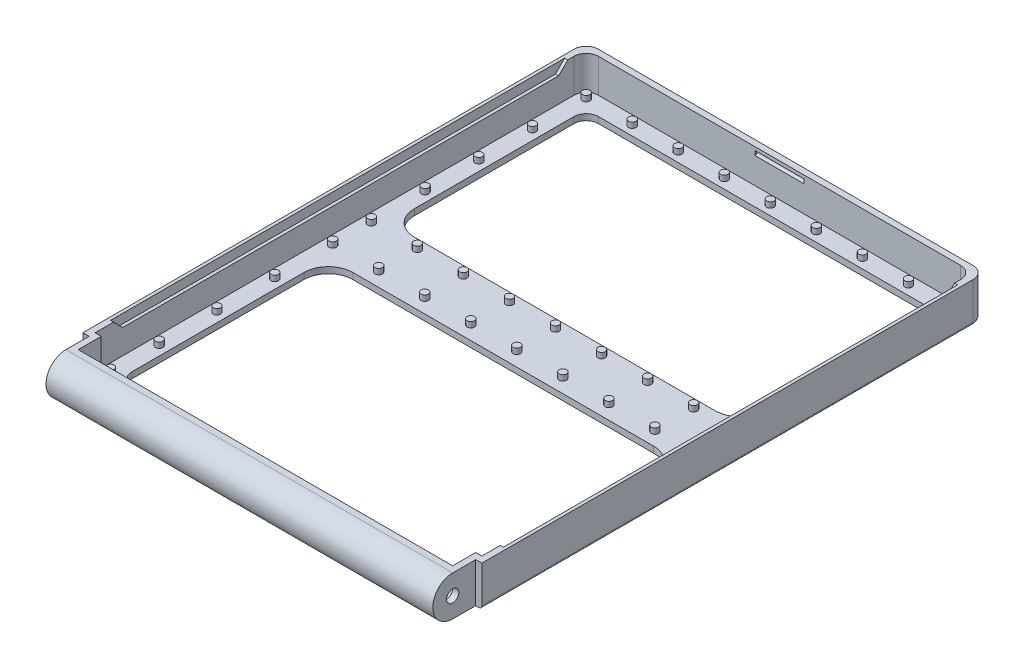
from build123d import *

# Parameters (mm, degrees)
SALIENTE_EXTRUIR1_DEPTH     = 13
CORTAR_EXTRUIR7_DEPTH       = 11
CORTAR_EXTRUIR9_DEPTH       = 140
CROQUIS10_R                 = 4.5
CORTAR_EXTRUIR10_DEPTH      = 122
CROQUIS11_W                 = 122
CROQUIS11_H                 = 12.524990812
CORTAR_EXTRUIR12_DEPTH      = 11
CORTAR_EXTRUIR13_DEPTH      = 130
CORTAR_EXTRUIR13_DEPTH_BACK = 130
CROQUIS12_R                 = 2
REDONDEO1_R                 = 1
CORTAR_EXTRUIR14_DEPTH      = 1
CORTAR_EXTRUIR15_DEPTH      = 1
CORTAR_EXTRUIR17_DEPTH      = 4
CROQUIS21_RX                = 35
CROQUIS21_RY                = 8
CORTAR_EXTRUIR19_DEPTH      = 0.4
CROQUIS22_R                 = 1.2
SALIENTE_EXTRUIR3_DEPTH     = 1.8
CROQUIS25_R                 = 0.7
CORTAR_EXTRUIR20_DEPTH      = 16


with BuildPart() as part:
    # Croquis1 → Saliente-Extruir1 (new body)
    with BuildSketch(Plane(origin=(0, 0, 0), x_dir=(1, 0, 0), z_dir=(0, 1, 0))):
        with BuildLine():
            Line((130, 0), (128, 0))
            Line((128, 0), (128, -14))
            Line((128, -14), (2, -14))
            Line((2, -14), (2, 0))
            Line((2, 0), (0, 0))
            Line((0, 0), (0, 160))
            ThreePointArc((0, 160), (1.171572875, 162.828427125), (4, 164))
            Line((4, 164), (126, 164))
            ThreePointArc((126, 164), (128.828427125, 162.828427125), (130, 160))
            Line((130, 160), (130, 0))
        make_face()
    extrude(amount=SALIENTE_EXTRUIR1_DEPTH)

    # Croquis7 → Cortar-Extruir7 (cut)
    with BuildSketch(Plane(origin=(0, 13, 0), x_dir=(1, 0, 0), z_dir=(0, 1, 0))):
        with BuildLine():
            ThreePointArc((124, 162), (126.828427125, 160.828427125), (128, 158))
            Line((128, 158), (128, 2))
            Line((128, 2), (2, 2))
            Line((2, 2), (2, 158))
            ThreePointArc((2, 158), (3.171572875, 160.828427125), (6, 162))
            Line((6, 162), (62.001239157, 162))
            Line((62.001239157, 162), (124, 162))
        make_face()
    extrude(amount=-CORTAR_EXTRUIR7_DEPTH, mode=Mode.SUBTRACT)

    # Croquis8 → Cortar-Extruir9 (cut)
    with BuildSketch(Plane(origin=(128, 0, 0), x_dir=(0, 0, -1), z_dir=(1, 0, 0))):
        with BuildLine():
            ThreePointArc((-14, 6.5), (-12.096194078, 11.096194078), (-7.5, 13))
            Line((-7.5, 13), (-14, 13))
            Line((-14, 13), (-14, 6.5))
        make_face()
        with BuildLine():
            Line((-14, 0), (-7.5, 0))
            ThreePointArc((-7.5, 0), (-12.096194078, 1.903805922), (-14, 6.5))
            Line((-14, 6.5), (-14, 0))
        make_face()
    extrude(amount=-CORTAR_EXTRUIR9_DEPTH, mode=Mode.SUBTRACT)

    # Croquis10 → Cortar-Extruir10 (cut)
    with BuildSketch(Plane(origin=(4, 0, 0), x_dir=(0, 0, -1), z_dir=(1, 0, 0))):
        with Locations(Location((-7.5, 6.5, 0), (0, 0, 180))):
            Circle(CROQUIS10_R)
    extrude(amount=CORTAR_EXTRUIR10_DEPTH, mode=Mode.SUBTRACT)

    # Croquis11 → Cortar-Extruir12 (cut)
    with BuildSketch(Plane(origin=(0, 13, 0), x_dir=(1, 0, 0), z_dir=(0, 1, 0))):
        Polygon((4, 2), (4, -5.5), (6, -5.5), (126, -5.5), (126, 2), align=None)
        with Locations((65, 8.262495406)):
            Rectangle(CROQUIS11_W, CROQUIS11_H)
    extrude(amount=-CORTAR_EXTRUIR12_DEPTH, mode=Mode.SUBTRACT)

    # Croquis12 → Cortar-Extruir13 (cut, two sides: drawn at the far end of the back side and taken through both)
    with BuildSketch(Plane(origin=(4, 0, 0), x_dir=(0, 0, -1), z_dir=(1, 0, 0)).offset(-CORTAR_EXTRUIR13_DEPTH_BACK)):
        with Locations((-7.5, 6.5)):
            Circle(CROQUIS12_R)
    extrude(amount=CORTAR_EXTRUIR13_DEPTH + CORTAR_EXTRUIR13_DEPTH_BACK, mode=Mode.SUBTRACT)

    # Redondeo1
    redondeo1_edges = [part.edges().sort_by_distance(p)[0] for p in [
        (128.828427125, 0, -162.828427125),
        (130, 0, -80),
        (0, 0, -80),
        (1.171572875, 0, -162.828427125),
        (65, 0, -164),
    ]]
    fillet(redondeo1_edges, radius=REDONDEO1_R)

    # Croquis17 → Cortar-Extruir14 (cut)
    with BuildSketch(Plane(origin=(2, 0, 0), x_dir=(0, 0, -1), z_dir=(1, 0, 0))):
        Polygon((153, 10), (11, 10), (8, 13), (156, 13), align=None)
    extrude(amount=-CORTAR_EXTRUIR14_DEPTH, mode=Mode.SUBTRACT)

    # Croquis19 → Cortar-Extruir15 (cut)
    with BuildSketch(Plane(origin=(128, 0, 0), x_dir=(0, 0, -1), z_dir=(1, 0, 0))):
        Polygon((11, 10), (153, 10), (156, 13), (8, 13), align=None)
    extrude(amount=CORTAR_EXTRUIR15_DEPTH, mode=Mode.SUBTRACT)

    # Croquis20 → Cortar-Extruir17 (cut)
    with BuildSketch(Plane.XZ):
        with BuildLine():
            Line((85, -72), (114, -72))
            ThreePointArc((114, -72), (119.656854249, -69.656854249), (122, -64))
            Line((122, -64), (122, -24.159979327))
            Line((122, -24.159979327), (122, -8))
            ThreePointArc((122, -8), (120.828427125, -5.171572875), (118, -4))
            Line((118, -4), (12, -4))
            ThreePointArc((12, -4), (9.171572875, -5.171572875), (8, -8))
            Line((8, -8), (8, -64))
            ThreePointArc((8, -64), (10.343145751, -69.656854249), (16, -72))
            Line((16, -72), (45, -72))
            Line((45, -72), (85, -72))
        make_face()
        with BuildLine():
            Line((45, -92), (85, -92))
            Line((85, -92), (114, -92))
            ThreePointArc((114, -92), (119.656854249, -94.343145751), (122, -100))
            Line((122, -100), (122, -152))
            ThreePointArc((122, -152), (120.828427125, -154.828427125), (118, -156))
            Line((118, -156), (68.281659804, -156))
            Line((68.281659804, -156), (12, -156))
            ThreePointArc((12, -156), (9.171572875, -154.828427125), (8, -152))
            Line((8, -152), (8, -100))
            ThreePointArc((8, -100), (10.343145751, -94.343145751), (16, -92))
            Line((16, -92), (45, -92))
        make_face()
    extrude(amount=-CORTAR_EXTRUIR17_DEPTH, mode=Mode.SUBTRACT)

    # Croquis21 → Cortar-Extruir19 (cut)
    with BuildSketch(Plane.XZ):
        with Locations(Location((64.555474057, -81.656567249), (0, 0, 180))):
            Ellipse(CROQUIS21_RX, CROQUIS21_RY)
    extrude(amount=-CORTAR_EXTRUIR19_DEPTH, mode=Mode.SUBTRACT)

    # Croquis22 → Saliente-Extruir3 (add)
    with BuildSketch(Plane(origin=(0, 2, 0), x_dir=(1, 0, 0), z_dir=(0, 1, 0))):
        with Locations(Location((20, 159, 0), (0, 0, 270))):
            Circle(CROQUIS22_R)
        with Locations(Location((35, 159, 0), (0, 0, 270))):
            Circle(CROQUIS22_R)
        with Locations(Location((50, 159, 0), (0, 0, 270))):
            Circle(CROQUIS22_R)
        with Locations(Location((65, 159, 0), (0, 0, 270))):
            Circle(CROQUIS22_R)
        with Locations(Location((80, 159, 0), (0, 0, 270))):
            Circle(CROQUIS22_R)
        with Locations(Location((95, 159, 0), (0, 0, 270))):
            Circle(CROQUIS22_R)
        with Locations(Location((110, 159, 0), (0, 0, 270))):
            Circle(CROQUIS22_R)
        with Locations(Location((125, 159, 0), (0, 0, 270))):
            Circle(CROQUIS22_R)
        with Locations(Location((5, 159, 0), (0, 0, 270))):
            Circle(CROQUIS22_R)
        with Locations(Location((5, 89, 0), (0, 0, 270))):
            Circle(CROQUIS22_R)
        with Locations(Location((20, 89, 0), (0, 0, 270))):
            Circle(CROQUIS22_R)
        with Locations(Location((35, 89, 0), (0, 0, 270))):
            Circle(CROQUIS22_R)
        with Locations(Location((50, 89, 0), (0, 0, 270))):
            Circle(CROQUIS22_R)
        with Locations(Location((65, 89, 0), (0, 0, 270))):
            Circle(CROQUIS22_R)
        with Locations(Location((80, 89, 0), (0, 0, 270))):
            Circle(CROQUIS22_R)
        with Locations(Location((95, 89, 0), (0, 0, 270))):
            Circle(CROQUIS22_R)
        with Locations(Location((110, 89, 0), (0, 0, 270))):
            Circle(CROQUIS22_R)
        with Locations(Location((125, 89, 0), (0, 0, 270))):
            Circle(CROQUIS22_R)
        with Locations(Location((125, 76.396213734, 0), (0, 0, 270))):
            Circle(CROQUIS22_R)
        with Locations(Location((110, 76.396213734, 0), (0, 0, 270))):
            Circle(CROQUIS22_R)
        with Locations(Location((80, 76.396213734, 0), (0, 0, 270))):
            Circle(CROQUIS22_R)
        with Locations(Location((65, 76.396213734, 0), (0, 0, 270))):
            Circle(CROQUIS22_R)
        with Locations(Location((95, 76.396213734, 0), (0, 0, 270))):
            Circle(CROQUIS22_R)
        with Locations(Location((50, 76.396213734, 0), (0, 0, 270))):
            Circle(CROQUIS22_R)
        with Locations(Location((20, 76.396213734, 0), (0, 0, 270))):
            Circle(CROQUIS22_R)
        with Locations(Location((35, 76.396213734, 0), (0, 0, 270))):
            Circle(CROQUIS22_R)
        with Locations(Location((5, 76.396213734, 0), (0, 0, 270))):
            Circle(CROQUIS22_R)
        with Locations(Location((20, 1, 0), (0, 0, 270))):
            Circle(CROQUIS22_R)
        with Locations(Location((35, 1, 0), (0, 0, 270))):
            Circle(CROQUIS22_R)
        with Locations(Location((50, 1, 0), (0, 0, 270))):
            Circle(CROQUIS22_R)
        with Locations(Location((65, 1, 0), (0, 0, 270))):
            Circle(CROQUIS22_R)
        with Locations(Location((80, 1, 0), (0, 0, 270))):
            Circle(CROQUIS22_R)
        with Locations(Location((95, 1, 0), (0, 0, 270))):
            Circle(CROQUIS22_R)
        with Locations(Location((110, 1, 0), (0, 0, 270))):
            Circle(CROQUIS22_R)
        with Locations(Location((5, 38.698106867, 0), (0, 0, 270))):
            Circle(CROQUIS22_R)
        with Locations(Location((125, 38.698106867, 0), (0, 0, 270))):
            Circle(CROQUIS22_R)
        with Locations(Location((5, 57.5471603, 0), (0, 0, 270))):
            Circle(CROQUIS22_R)
        with Locations(Location((125, 57.5471603, 0), (0, 0, 270))):
            Circle(CROQUIS22_R)
        with Locations(Location((5, 19.849053433, 0), (0, 0, 270))):
            Circle(CROQUIS22_R)
        with Locations(Location((125, 19.849053433, 0), (0, 0, 270))):
            Circle(CROQUIS22_R)
        with Locations(Location((125, 4, 0), (0, 0, 270))):
            Circle(CROQUIS22_R)
        with Locations(Location((5, 4, 0), (0, 0, 270))):
            Circle(CROQUIS22_R)
        with Locations(Location((125, 141.5, 0), (0, 0, 270))):
            Circle(CROQUIS22_R)
        with Locations(Location((125, 124, 0), (0, 0, 270))):
            Circle(CROQUIS22_R)
        with Locations(Location((125, 106.5, 0), (0, 0, 270))):
            Circle(CROQUIS22_R)
        with Locations(Location((5, 141.5, 0), (0, 0, 270))):
            Circle(CROQUIS22_R)
        with Locations(Location((5, 124, 0), (0, 0, 270))):
            Circle(CROQUIS22_R)
        with Locations(Location((5, 106.5, 0), (0, 0, 270))):
            Circle(CROQUIS22_R)
    extrude(amount=SALIENTE_EXTRUIR3_DEPTH)

    # Croquis25 → Cortar-Extruir20 (cut)
    with BuildSketch(Plane(origin=(73, 0, 0), x_dir=(0, 0, -1), z_dir=(1, 0, 0))):
        with Locations((162, 11.2)):
            Circle(CROQUIS25_R)
    extrude(amount=-CORTAR_EXTRUIR20_DEPTH, mode=Mode.SUBTRACT)


solid = part.part
